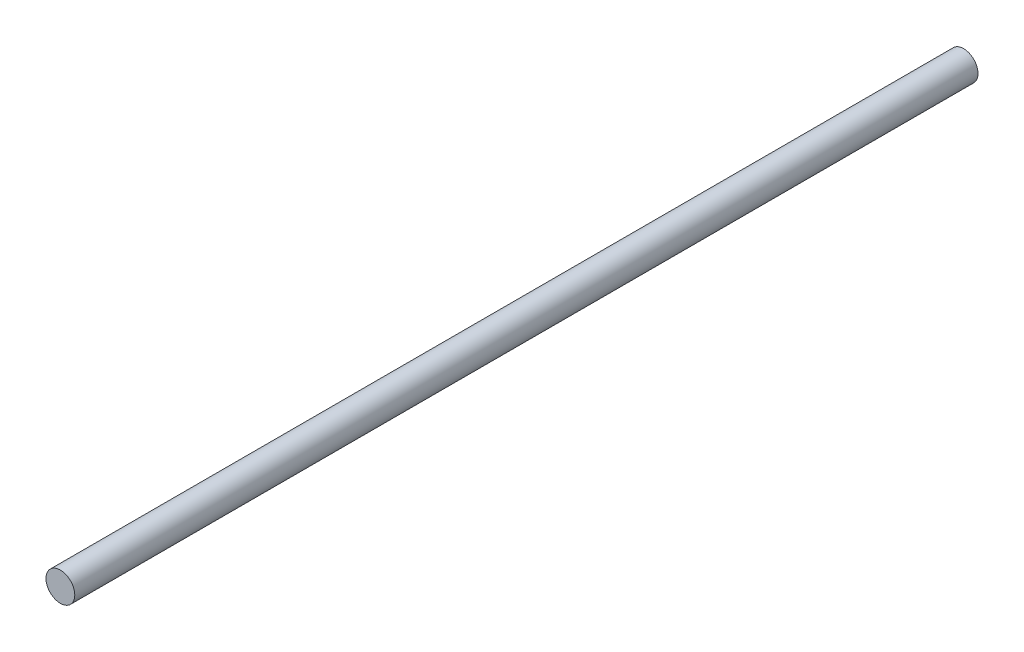
from build123d import *

# Parameters (mm, degrees)
SKETCH1_R           = 12.7
BOSS_EXTRUDE1_DEPTH = 796.2


with BuildPart() as part:
    # Sketch1 → Boss-Extrude1 (new body)
    with BuildSketch(Plane.XY):
        Circle(SKETCH1_R)
    extrude(amount=BOSS_EXTRUDE1_DEPTH)


solid = part.part
